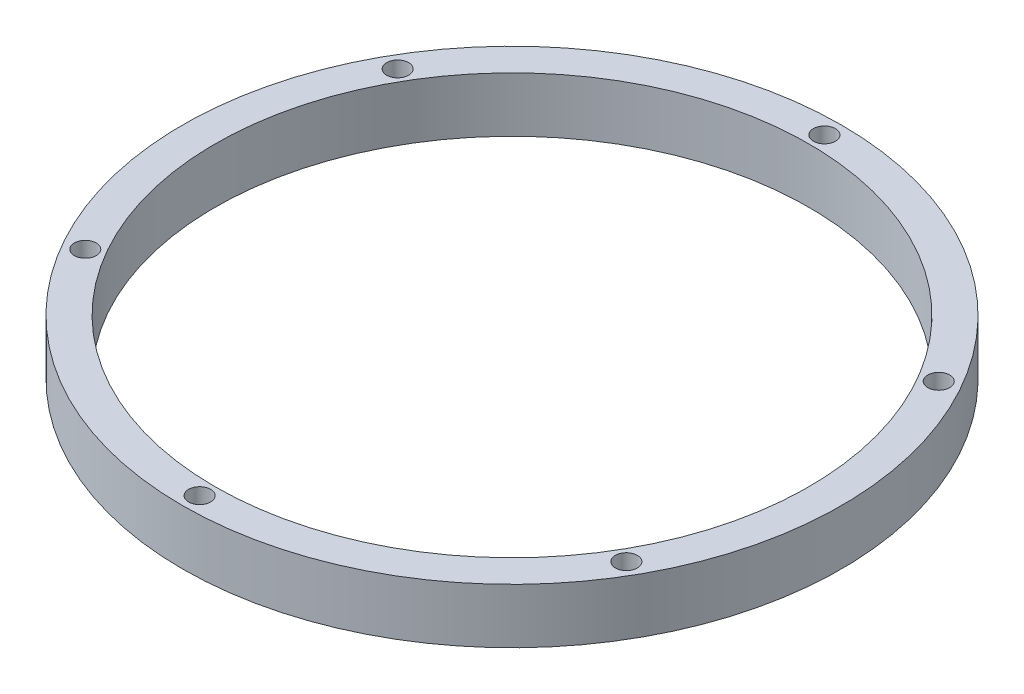
from build123d import *

# Parameters (mm, degrees)
SKETCH_1_R      = 48
SKETCH_1_R_2    = 43.25
SKETCH_1_R_3    = 1.6
EXTRUDE_1_DEPTH = 8


with BuildPart() as part:
    # 草图1 → 凸台-拉伸1 (new body)
    with BuildSketch(Plane(origin=(0, 0, 0), x_dir=(1, 0, 0), z_dir=(0, 1, 0))):
        with Locations(Location((0, 0, 0), (0, 0, 270))):
            Circle(SKETCH_1_R)
        with Locations(Location((0, 0, 0), (0, 0, 270))):
            Circle(SKETCH_1_R_2, mode=Mode.SUBTRACT)
        with Locations(Location((0, 45.5, 0), (0, 0, 270))):
            Circle(SKETCH_1_R_3, mode=Mode.SUBTRACT)
        with Locations(Location((39.404155872, 22.75, 0), (0, 0, 270))):
            Circle(SKETCH_1_R_3, mode=Mode.SUBTRACT)
        with Locations(Location((39.404155872, -22.75, 0), (0, 0, 270))):
            Circle(SKETCH_1_R_3, mode=Mode.SUBTRACT)
        with Locations(Location((0, -45.5, 0), (0, 0, 270))):
            Circle(SKETCH_1_R_3, mode=Mode.SUBTRACT)
        with Locations(Location((-39.404155872, -22.75, 0), (0, 0, 270))):
            Circle(SKETCH_1_R_3, mode=Mode.SUBTRACT)
        with Locations(Location((-39.404155872, 22.75, 0), (0, 0, 270))):
            Circle(SKETCH_1_R_3, mode=Mode.SUBTRACT)
    extrude(amount=EXTRUDE_1_DEPTH)


solid = part.part
